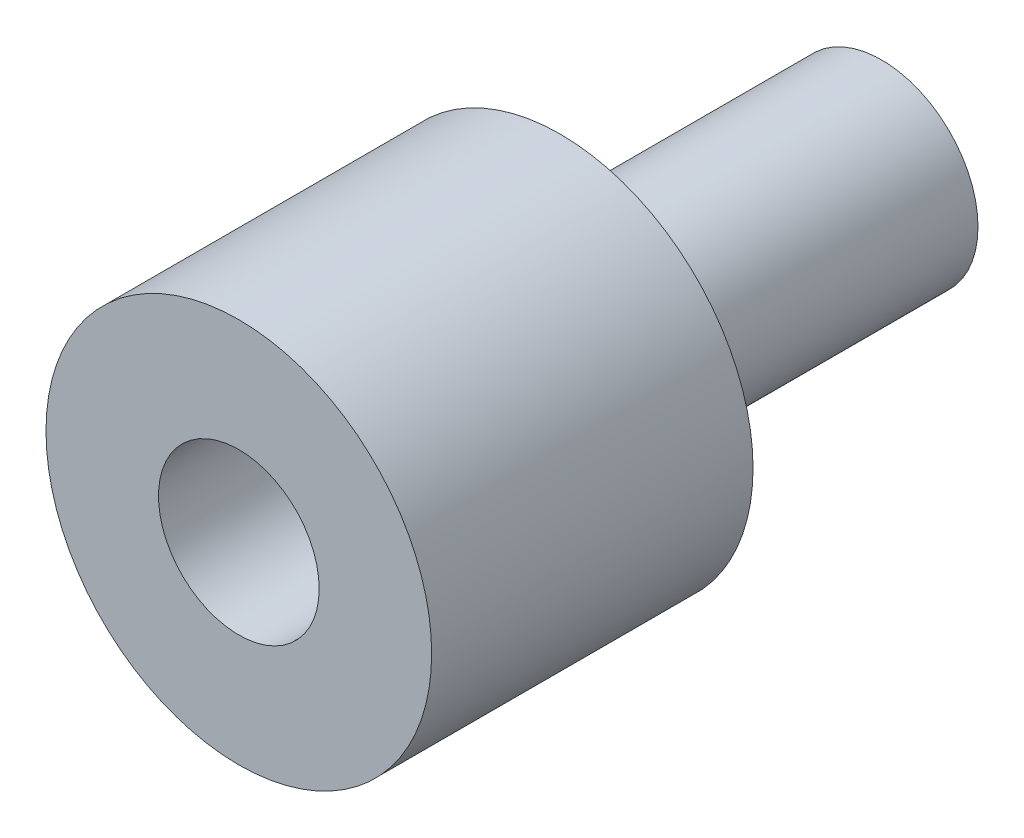
from build123d import *

# Parameters (mm, degrees)
SKETCH1_R           = 12
BOSS_EXTRUDE1_DEPTH = 20
SKETCH1_4_R         = 6
BOSS_EXTRUDE2_DEPTH = 20
SKETCH2_R           = 5
CUT_EXTRUDE1_DEPTH  = 12


with BuildPart() as part:
    # Sketch1 → Boss-Extrude1 (new body)
    with BuildSketch(Plane.XY):
        Circle(SKETCH1_R)
    extrude(amount=BOSS_EXTRUDE1_DEPTH)

    # Sketch1<4> → Boss-Extrude2 (add)
    with BuildSketch(Plane.XY):
        Circle(SKETCH1_4_R)
    extrude(amount=-BOSS_EXTRUDE2_DEPTH)

    # Sketch2 → Cut-Extrude1 (cut)
    with BuildSketch(Plane.XY.offset(20)):
        Circle(SKETCH2_R)
    extrude(amount=-CUT_EXTRUDE1_DEPTH, mode=Mode.SUBTRACT)


solid = part.part
